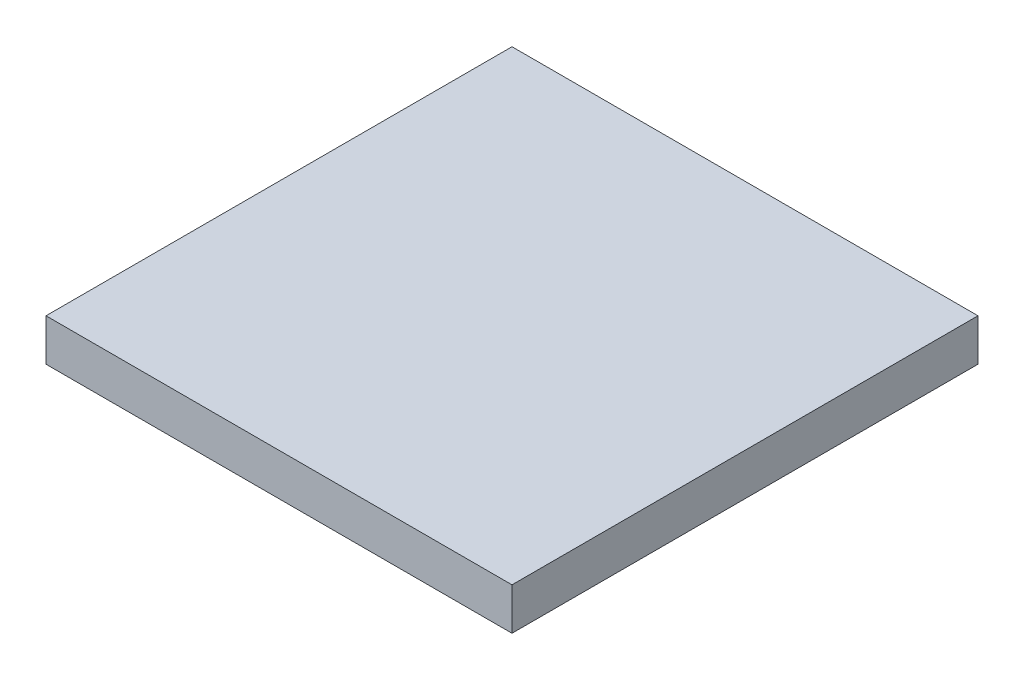
from build123d import *

# Parameters (mm, degrees)
SKETCH1_W           = 14.1
SKETCH1_H           = 14.1
BOSS_EXTRUDE1_DEPTH = 1.27


with BuildPart() as part:
    # Sketch1 → Boss-Extrude1 (new body)
    with BuildSketch(Plane(origin=(0, 0, 0), x_dir=(1, 0, 0), z_dir=(0, 1, 0))):
        with Locations((7.05, 7.05)):
            Rectangle(SKETCH1_W, SKETCH1_H)
    extrude(amount=BOSS_EXTRUDE1_DEPTH)


solid = part.part
